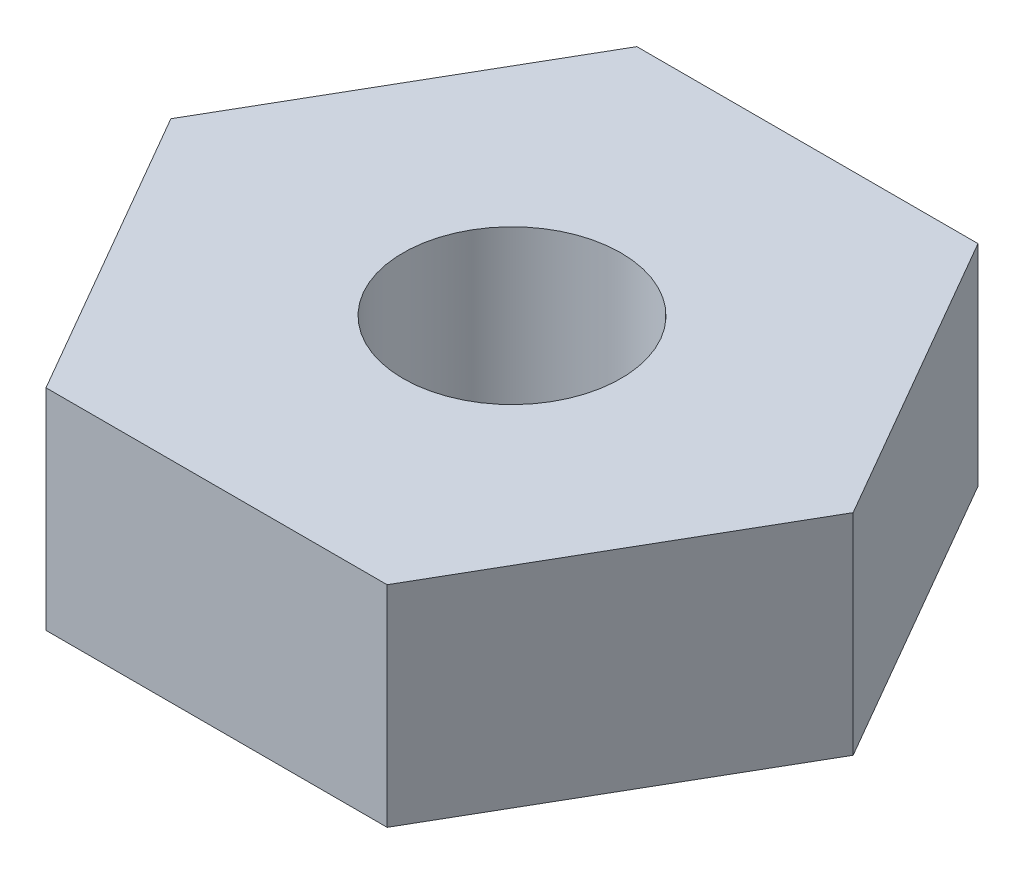
from build123d import *

# Parameters (mm, degrees)
BOSS_EXTRUDE1_DEPTH = 2.7686
SKETCH2_R           = 1.4351
CUT_EXTRUDE2_DEPTH  = 7.558939355


with BuildPart() as part:
    # Sketch1 → Boss-Extrude1 (new body)
    with BuildSketch(Plane(origin=(0, 0, 0), x_dir=(1, 0, 0), z_dir=(0, 1, 0))):
        Polygon((-2.24736479, 3.89255), (-4.494729581, 0), (-2.24736479, -3.89255), (2.24736479, -3.89255), (4.494729581, 0), (2.24736479, 3.89255), align=None)
    extrude(amount=BOSS_EXTRUDE1_DEPTH)

    # Sketch2 → Cut-Extrude2 (cut, through all)
    with BuildSketch(Plane(origin=(0, 0, 0), x_dir=(1, 0, 0), z_dir=(0, 1, 0))):
        with Locations(Location((0, 0, 0), (0, 0, 270))):
            Circle(SKETCH2_R)
    extrude(amount=CUT_EXTRUDE2_DEPTH, mode=Mode.SUBTRACT)


solid = part.part
